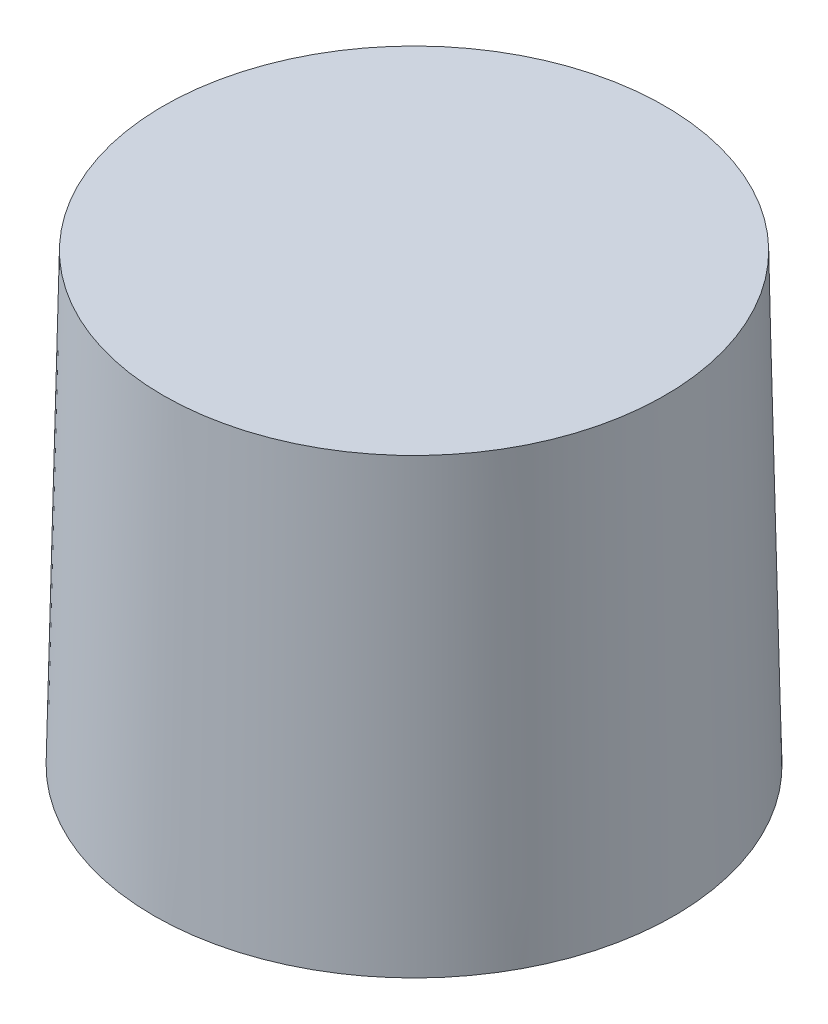
from build123d import *


with BuildPart() as part:
    # Esboço1 → Revolução1 (revolve)
    with BuildSketch(Plane.XY, mode=Mode.PRIVATE) as revolu_o1_sk:
        Polygon((0, 0), (-27, 0), (-28.014084507, -48), (-26.013638217, -48), (-25.04181666, -2.00044629), (0, -2.00044629), align=None)
    revolve(revolu_o1_sk.sketch.rotate(Axis((0, 57.835596227, 0), (0, -1, 0)), 270), axis=Axis((0, 57.835596227, 0), (0, -1, 0)))


solid = part.part
